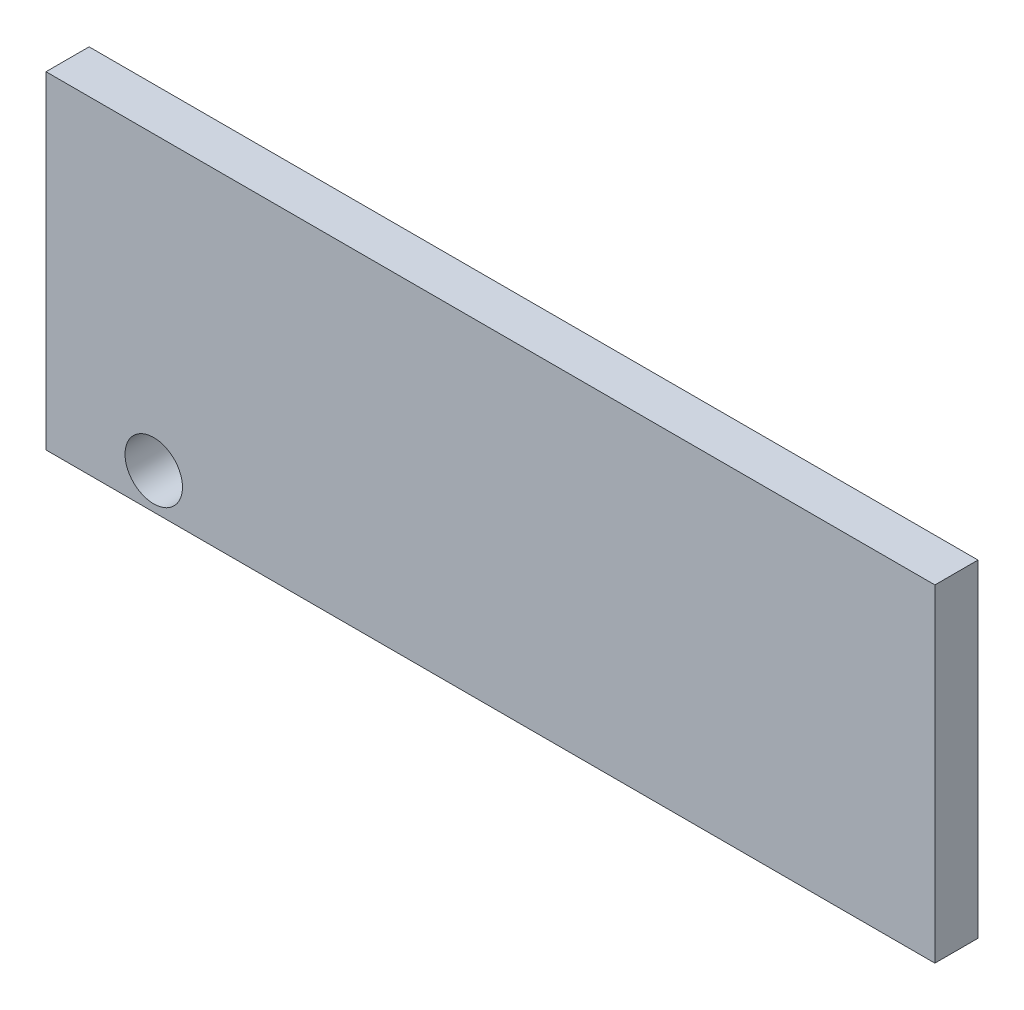
from build123d import *

# Parameters (mm, degrees)
ESQUISSE1_W        = 123.759950164
ESQUISSE1_H        = 45.608387386
ESQUISSE1_R        = 4
BOSS_EXTRU_1_DEPTH = 6


with BuildPart() as part:
    # Esquisse1 → Boss.-Extru.1 (new body)
    with BuildSketch(Plane.XY):
        Rectangle(ESQUISSE1_W, ESQUISSE1_H)
        with Locations((-46.879975082, -17.804193693)):
            Circle(ESQUISSE1_R, mode=Mode.SUBTRACT)
    extrude(amount=BOSS_EXTRU_1_DEPTH)


solid = part.part
